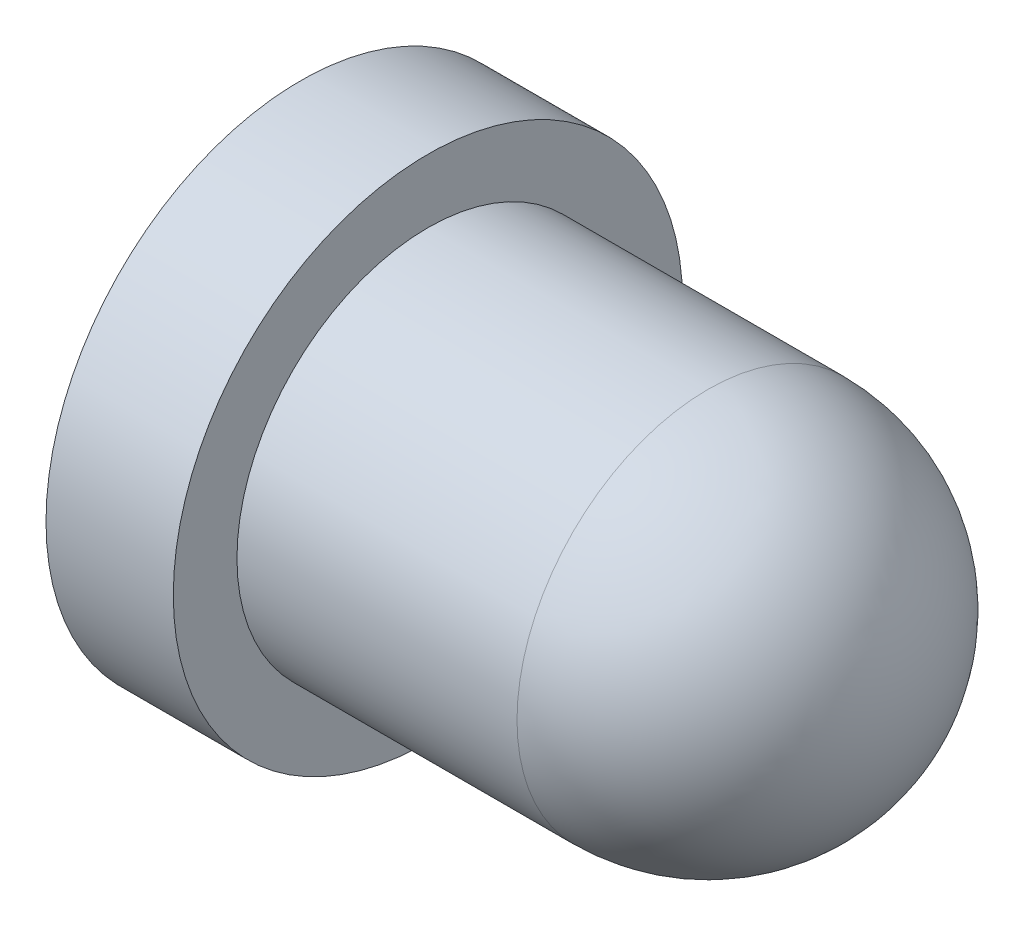
from build123d import *

# Parameters (mm, degrees)
SKETCH1_R           = 2
BOSS_EXTRUDE1_DEPTH = 1
SKETCH2_R           = 1.5
BOSS_EXTRUDE2_DEPTH = 3.7
FILLET1_R           = 1.5


with BuildPart() as part:
    # Sketch1 → Boss-Extrude1 (new body)
    with BuildSketch(Plane(origin=(0, 0, 0), x_dir=(0, 0, -1), z_dir=(1, 0, 0))):
        Circle(SKETCH1_R)
    extrude(amount=BOSS_EXTRUDE1_DEPTH)

    # Sketch2 → Boss-Extrude2 (add)
    with BuildSketch(Plane(origin=(1, 0, 0), x_dir=(0, 0, -1), z_dir=(1, 0, 0))):
        Circle(SKETCH2_R)
    extrude(amount=BOSS_EXTRUDE2_DEPTH)

    # Fillet1
    fillet1_edges = [part.edges().sort_by_distance(p)[0] for p in [
        (4.7, 0, 1.5),
    ]]
    fillet(fillet1_edges, radius=FILLET1_R)


solid = part.part
